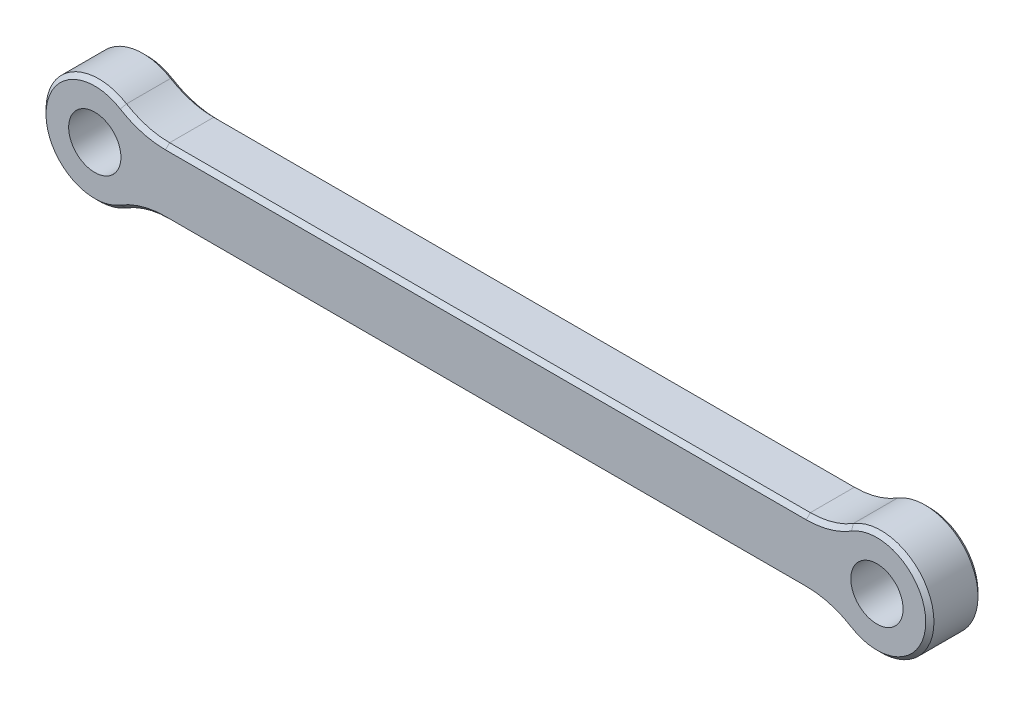
from build123d import *

# Parameters (mm, degrees)
SKETCH2_R           = 3.175
BOSS_EXTRUDE1_DEPTH = 6.35
FILLET1_R           = 10
CHAMFER1_SIZE       = 0.5


with BuildPart() as part:
    # Sketch2 → Boss-Extrude1 (new body)
    # profile 1 of 5: a face of its own
    with BuildSketch(Plane.XY):
        with BuildLine():
            Line((89.972015811, 4), (5.027984189, 4))
            ThreePointArc((5.027984189, 4), (6.065699606, 2.118469564), (6.425, 0))
            ThreePointArc((6.425, 0), (6.065699606, -2.118469564), (5.027984189, -4))
            Line((5.027984189, -4), (89.972015811, -4))
            ThreePointArc((89.972015811, -4), (88.575, 0), (89.972015811, 4))
        make_face()
    # profile 2 of 5: a face of its own
    with BuildSketch(Plane.XY):
        with BuildLine():
            Line((95, 4), (89.972015811, 4))
            ThreePointArc((89.972015811, 4), (88.575, 0), (89.972015811, -4))
            Line((89.972015811, -4), (95, -4))
            ThreePointArc((95, -4), (99, 0), (95, 4))
        make_face()
        with Locations((95, 0)):
            Circle(SKETCH2_R, mode=Mode.SUBTRACT)
    # profile 3 of 5: a face of its own
    with BuildSketch(Plane.XY):
        with BuildLine():
            ThreePointArc((101.425, 0), (97.118469564, 6.065699606), (89.972015811, 4))
            Line((89.972015811, 4), (95, 4))
            ThreePointArc((95, 4), (99, 0), (95, -4))
            Line((95, -4), (89.972015811, -4))
            ThreePointArc((89.972015811, -4), (97.118469564, -6.065699606), (101.425, 0))
        make_face()
    # profile 4 of 5: a face of its own
    with BuildSketch(Plane.XY):
        with BuildLine():
            Line((5.027984189, 4), (0, 4))
            ThreePointArc((0, 4), (-4, 0), (0, -4))
            Line((0, -4), (5.027984189, -4))
            ThreePointArc((5.027984189, -4), (6.065699606, -2.118469564), (6.425, 0))
            ThreePointArc((6.425, 0), (6.065699606, 2.118469564), (5.027984189, 4))
        make_face()
        Circle(SKETCH2_R, mode=Mode.SUBTRACT)
    # profile 5 of 5: a face of its own
    with BuildSketch(Plane.XY):
        with BuildLine():
            ThreePointArc((0, -4), (-4, 0), (0, 4))
            Line((0, 4), (5.027984189, 4))
            ThreePointArc((5.027984189, 4), (-6.425, 0), (5.027984189, -4))
            Line((5.027984189, -4), (0, -4))
        make_face()
    extrude(amount=BOSS_EXTRUDE1_DEPTH)

    # Fillet1
    fillet1_edges = [part.edges().sort_by_distance(p)[0] for p in [
        (89.972015811, 4, 3.175),
        (89.972015811, -4, 3.175),
        (5.027984189, -4, 3.175),
        (5.027984189, 4, 3.175),
    ]]
    fillet(fillet1_edges, radius=FILLET1_R)

    # Chamfer1
    chamfer1_edges = [part.edges().sort_by_distance(p)[0] for p in [
        (47.5, 4, 0),
        (47.5, 4, 6.35),
        (101.425, 0, 0),
        (101.425, 0, 6.35),
        (47.5, -4, 0),
        (47.5, -4, 6.35),
        (-6.425, 0, 0),
        (-6.425, 0, 6.35),
        (89.127426014, 4.376177452, 0),
        (89.127426014, 4.376177452, 6.35),
        (89.127426014, -4.376177452, 0),
        (89.127426014, -4.376177452, 6.35),
        (5.872573986, -4.376177452, 0),
        (5.872573986, -4.376177452, 6.35),
        (5.872573986, 4.376177452, 0),
        (5.872573986, 4.376177452, 6.35),
    ]]
    chamfer(chamfer1_edges, length=CHAMFER1_SIZE)


solid = part.part
